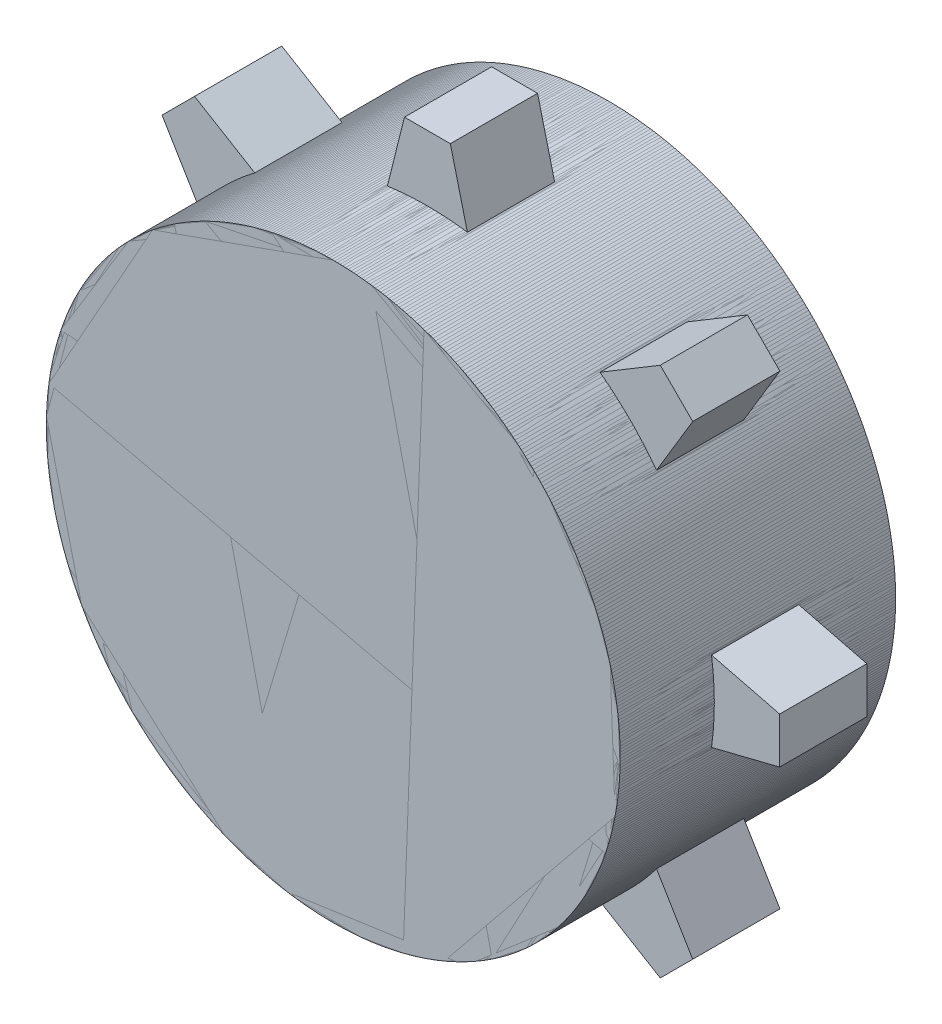
from build123d import *

# Parameters (mm, degrees)
SKETCH1_R           = 31.25
BOSS_EXTRUDE1_DEPTH = 15
BOSS_EXTRUDE2_DEPTH = 4.75
CIRPATTERN1_COUNT   = 8


with BuildPart() as part:
    # Sketch1 → Boss-Extrude1 (new, symmetric)
    with BuildSketch(Plane.XY):
        Circle(SKETCH1_R)
    extrude(amount=BOSS_EXTRUDE1_DEPTH, both=True)

    # Sketch2 → Boss-Extrude2 (add, symmetric)
    with BuildSketch(Plane.XY):
        Polygon((-28.372098708, -5), (-28.372098708, 5), (-38.372098708, 2.5), (-38.372098708, -2.5), align=None)
    extrude(amount=BOSS_EXTRUDE2_DEPTH, both=True)


with BuildPart() as cirpattern1_1:
    # CirPattern1: pattern copy
    add(part.part.rotate(Axis((0, 0, 0), (0, 0, 1)), 1 * 360 / CIRPATTERN1_COUNT))


with BuildPart() as cirpattern1_2:
    # CirPattern1: pattern copy
    add(part.part.rotate(Axis((0, 0, 0), (0, 0, 1)), 2 * 360 / CIRPATTERN1_COUNT))


with BuildPart() as cirpattern1_3:
    # CirPattern1: pattern copy
    add(part.part.rotate(Axis((0, 0, 0), (0, 0, 1)), 3 * 360 / CIRPATTERN1_COUNT))


with BuildPart() as cirpattern1_4:
    # CirPattern1: pattern copy
    add(part.part.rotate(Axis((0, 0, 0), (0, 0, 1)), 4 * 360 / CIRPATTERN1_COUNT))


with BuildPart() as cirpattern1_5:
    # CirPattern1: pattern copy
    add(part.part.rotate(Axis((0, 0, 0), (0, 0, 1)), 5 * 360 / CIRPATTERN1_COUNT))


with BuildPart() as cirpattern1_6:
    # CirPattern1: pattern copy
    add(part.part.rotate(Axis((0, 0, 0), (0, 0, 1)), 6 * 360 / CIRPATTERN1_COUNT))


with BuildPart() as cirpattern1_7:
    # CirPattern1: pattern copy
    add(part.part.rotate(Axis((0, 0, 0), (0, 0, 1)), 7 * 360 / CIRPATTERN1_COUNT))


solid = Compound([part.part, cirpattern1_1.part, cirpattern1_2.part, cirpattern1_3.part, cirpattern1_4.part, cirpattern1_5.part, cirpattern1_6.part, cirpattern1_7.part])
